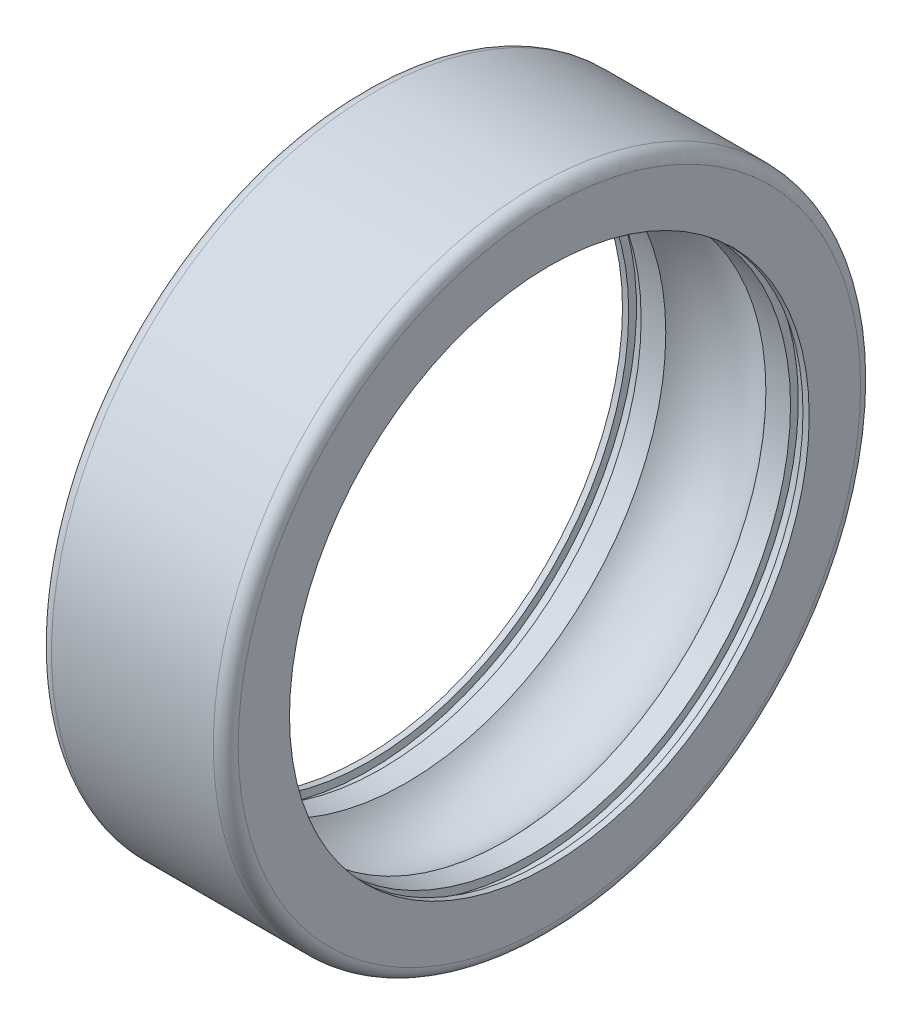
from build123d import *

# Parameters (mm, degrees)
SKETCH1_R           = 26
SKETCH1_R_2         = 20.875
BOSS_EXTRUDE1_DEPTH = 7.5
SKETCH2_R           = 5.25
SKETCH3_W           = 1
SKETCH3_H           = 0.625
FILLET1_R           = 1


with BuildPart() as part:
    # Sketch1 → Boss-Extrude1 (new, symmetric)
    with BuildSketch(Plane(origin=(0, 0, 0), x_dir=(0, 0, -1), z_dir=(1, 0, 0))):
        Circle(SKETCH1_R)
        Circle(SKETCH1_R_2, mode=Mode.SUBTRACT)
    extrude(amount=BOSS_EXTRUDE1_DEPTH, both=True)

    # Sketch2 → Cut-Revolve1 (revolve, cut)
    with BuildSketch(Plane.XY, mode=Mode.PRIVATE) as cut_revolve1_sk:
        with Locations((0, 17.5)):
            Circle(SKETCH2_R)
    revolve(cut_revolve1_sk.sketch.rotate(Axis((0, 0, 0), (1, 0, 0)), 90), axis=Axis((0, 0, 0), (1, 0, 0)), mode=Mode.SUBTRACT)

    # Sketch3 → Cut-Revolve2 (revolve, cut)
    with BuildSketch(Plane.XY, mode=Mode.PRIVATE) as cut_revolve2_sk:
        with Locations((-6.5, 21.1875)):
            Rectangle(SKETCH3_W, SKETCH3_H)
        with Locations((6.5, 21.1875)):
            Rectangle(SKETCH3_W, SKETCH3_H)
    revolve(cut_revolve2_sk.sketch.rotate(Axis((0, 0, 0), (1, 0, 0)), 90), axis=Axis((0, 0, 0), (1, 0, 0)), mode=Mode.SUBTRACT)

    # Fillet1
    fillet1_edges = [part.edges().sort_by_distance(p)[0] for p in [
        (-7.5, 0, 26),
        (7.5, 0, 26),
    ]]
    fillet(fillet1_edges, radius=FILLET1_R)


solid = part.part
